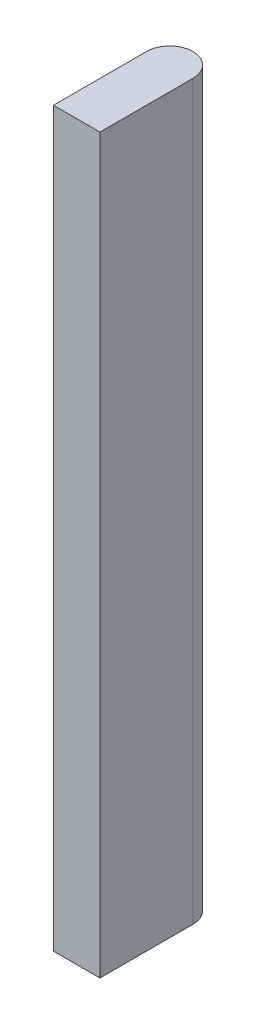
from build123d import *

# Parameters (mm, degrees)
BOSS_EXTRU_1_DEPTH = 31.5


with BuildPart() as part:
    # Esquisse1 → Boss.-Extru.1 (new body)
    with BuildSketch(Plane(origin=(0, 0, 0), x_dir=(1, 0, 0), z_dir=(0, 1, 0))):
        with BuildLine():
            Line((-1, -2.5), (1, -2.5))
            Line((1, -2.5), (1, 1.5))
            ThreePointArc((1, 1.5), (0, 2.5), (-1, 1.5))
            Line((-1, 1.5), (-1, -2.5))
        make_face()
    extrude(amount=BOSS_EXTRU_1_DEPTH)


solid = part.part
